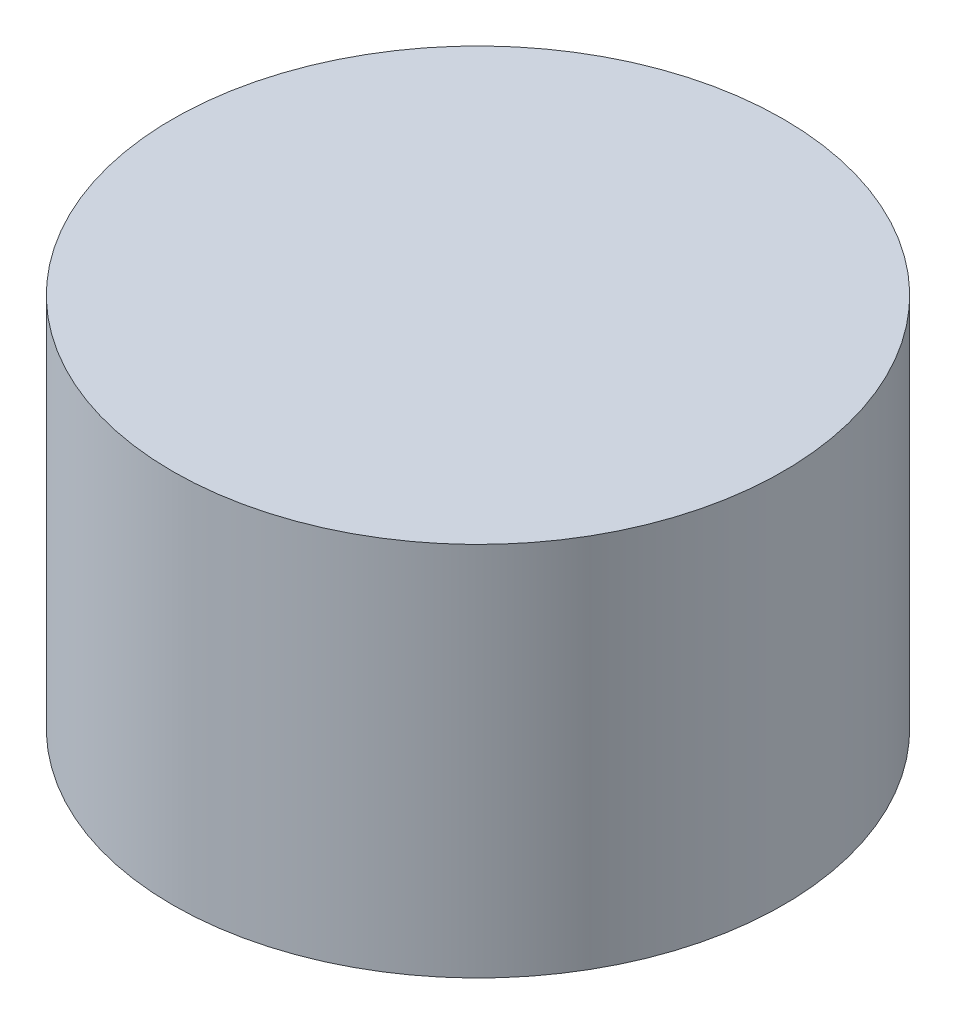
from build123d import *

# Parameters (mm, degrees)
SKETCH_1_R      = 16.259229669
EXTRUDE_1_DEPTH = 20


with BuildPart() as part:
    # Эскиз1 → Вытянуть1 (new body)
    with BuildSketch(Plane(origin=(0, 0, 0), x_dir=(1, 0, 0), z_dir=(0, 1, 0))):
        with Locations(Location((0, 0, 0), (0, 0, 270))):
            Circle(SKETCH_1_R)
    extrude(amount=EXTRUDE_1_DEPTH)


solid = part.part
